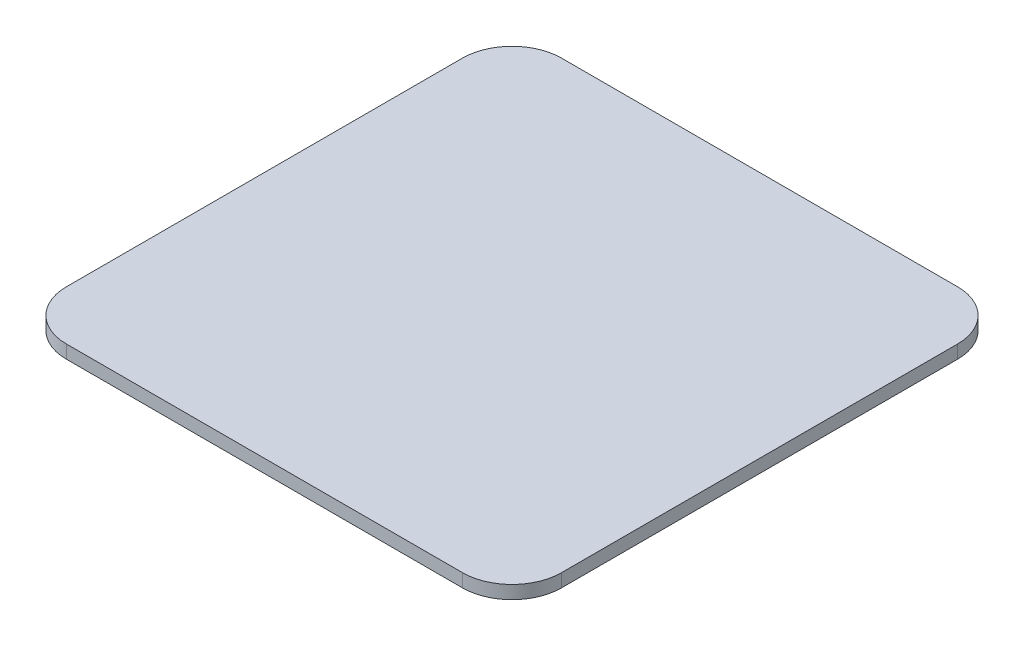
from build123d import *

# Parameters (mm, degrees)
BOSS_EXTRUDE3_DEPTH = 4


with BuildPart() as part:
    # Sketch1 → Boss-Extrude3 (new body)
    with BuildSketch(Plane(origin=(0, 0, 0), x_dir=(1, 0, 0), z_dir=(0, 1, 0))):
        with BuildLine():
            ThreePointArc((-75, -60), (-70.606601718, -70.606601718), (-60, -75))
            Line((-60, -75), (60, -75))
            ThreePointArc((60, -75), (70.606601718, -70.606601718), (75, -60))
            Line((75, -60), (75, 60))
            ThreePointArc((75, 60), (70.606601718, 70.606601718), (60, 75))
            Line((60, 75), (-60, 75))
            ThreePointArc((-60, 75), (-70.606601718, 70.606601718), (-75, 60))
            Line((-75, 60), (-75, -60))
        make_face()
    extrude(amount=BOSS_EXTRUDE3_DEPTH)


solid = part.part
